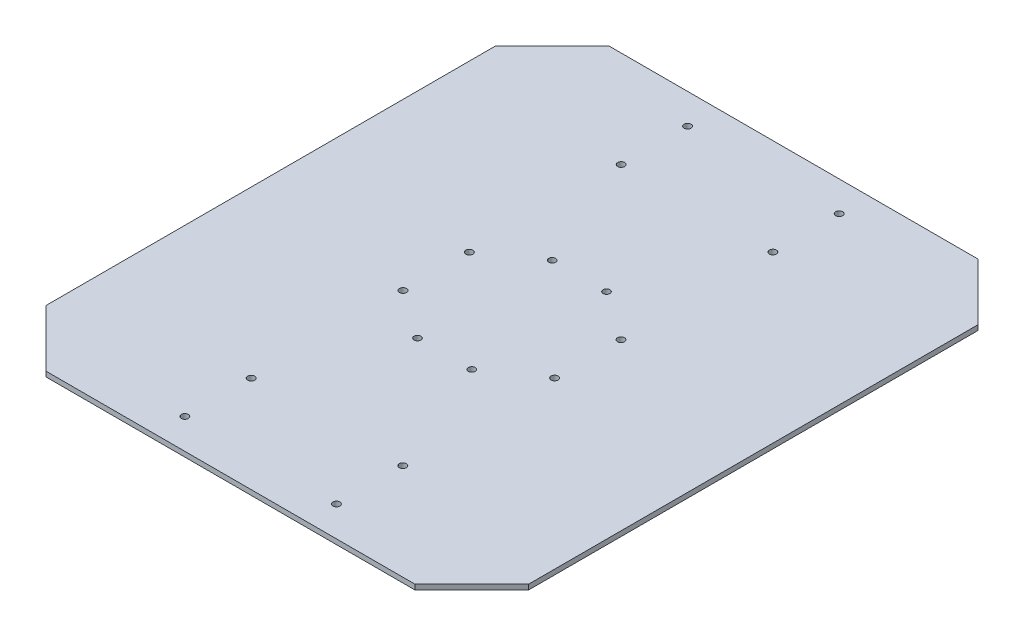
from build123d import *

# Parameters (mm, degrees)
SKETCH1_R           = 2.2225
BOSS_EXTRUDE1_DEPTH = 3.175
SKETCH2_R           = 2.159
CUT_EXTRUDE1_DEPTH  = 297.247830215


with BuildPart() as part:
    # Sketch1 → Boss-Extrude1 (new body)
    with BuildSketch(Plane(origin=(0, 0, 0), x_dir=(1, 0, 0), z_dir=(0, 1, 0))):
        Polygon((-85.365028143, 123.058976948), (-121.286052627, 87.137952464), (-121.286052627, -196.619998567), (-85.365028143, -232.541023052), (147.592922888, -232.541023052), (183.513947373, -196.619998567), (183.513947373, 87.137952464), (147.592922888, 123.058976948), align=None)
        with Locations(Location((-16.765052627, -213.491023052, 0), (0, 0, 270))):
            Circle(SKETCH1_R, mode=Mode.SUBTRACT)
        with Locations(Location((-16.765052627, -171.581023052, 0), (0, 0, 270))):
            Circle(SKETCH1_R, mode=Mode.SUBTRACT)
        with Locations(Location((-16.765052627, -75.696023052, 0), (0, 0, 270))):
            Circle(SKETCH1_R, mode=Mode.SUBTRACT)
        with Locations(Location((78.992947373, -213.491023052, 0), (0, 0, 270))):
            Circle(SKETCH1_R, mode=Mode.SUBTRACT)
        with Locations(Location((78.992947373, -171.581023052, 0), (0, 0, 270))):
            Circle(SKETCH1_R, mode=Mode.SUBTRACT)
        with Locations(Location((78.992947373, -75.696023052, 0), (0, 0, 270))):
            Circle(SKETCH1_R, mode=Mode.SUBTRACT)
        with Locations(Location((-16.765052627, -33.786023052, 0), (0, 0, 270))):
            Circle(SKETCH1_R, mode=Mode.SUBTRACT)
        with Locations(Location((-16.765052627, 62.098976948, 0), (0, 0, 270))):
            Circle(SKETCH1_R, mode=Mode.SUBTRACT)
        with Locations(Location((-16.765052627, 104.008976948, 0), (0, 0, 270))):
            Circle(SKETCH1_R, mode=Mode.SUBTRACT)
        with Locations(Location((78.992947373, -33.786023052, 0), (0, 0, 270))):
            Circle(SKETCH1_R, mode=Mode.SUBTRACT)
        with Locations(Location((78.992947373, 62.098976948, 0), (0, 0, 270))):
            Circle(SKETCH1_R, mode=Mode.SUBTRACT)
        with Locations(Location((78.992947373, 104.008976948, 0), (0, 0, 270))):
            Circle(SKETCH1_R, mode=Mode.SUBTRACT)
    extrude(amount=BOSS_EXTRUDE1_DEPTH)

    # Sketch2 → Cut-Extrude1 (cut, through all)
    with BuildSketch(Plane(origin=(0, 3.175, 0), x_dir=(1, 0, 0), z_dir=(0, 1, 0))):
        with Locations(Location((13.841947373, -12.069023052, 0), (0, 0, 270))):
            Circle(SKETCH2_R)
        with Locations(Location((48.131947373, -12.069023052, 0), (0, 0, 270))):
            Circle(SKETCH2_R)
        with Locations(Location((13.841947373, -97.159023052, 0), (0, 0, 270))):
            Circle(SKETCH2_R)
        with Locations(Location((48.131947373, -97.159023052, 0), (0, 0, 270))):
            Circle(SKETCH2_R)
    extrude(amount=-CUT_EXTRUDE1_DEPTH, mode=Mode.SUBTRACT)


solid = part.part
